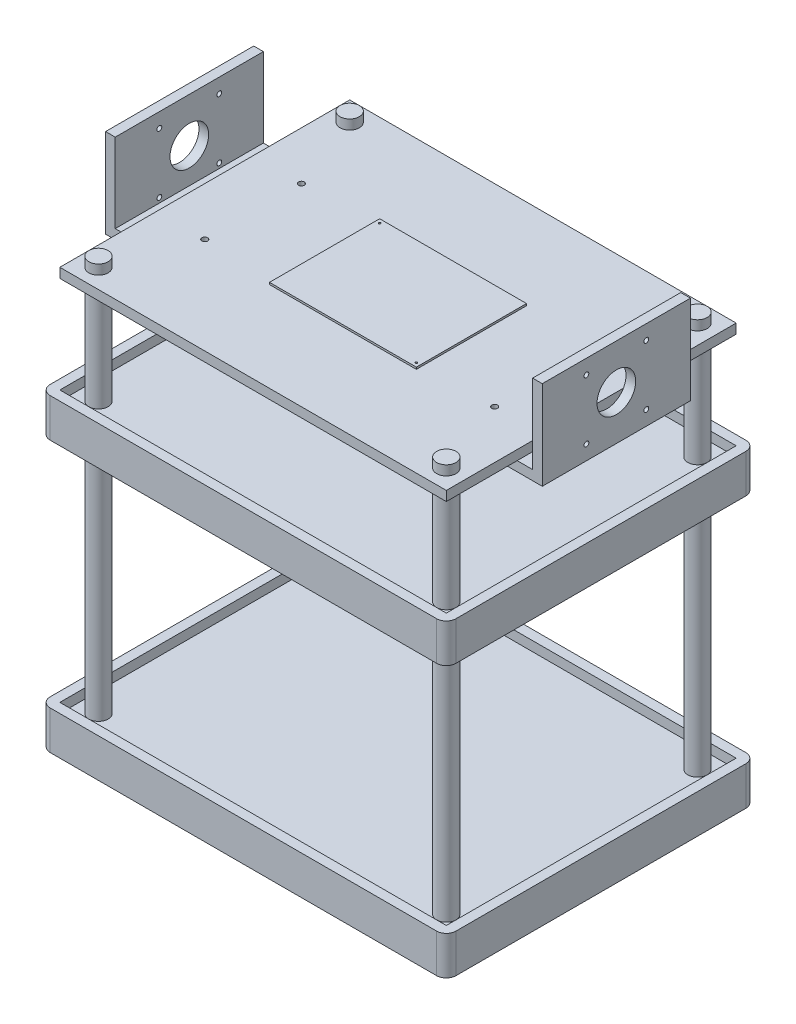
from build123d import *

# Parameters (mm, degrees)
SKETCH1_W            = 200
SKETCH1_H            = 150
BOSS_EXTRUDE1_DEPTH  = 5
SKETCH2_R            = 5
CUT_EXTRUDE1_DEPTH   = 10
SKETCH3_W            = 200
SKETCH3_H            = 150
SKETCH3_R            = 5
BOSS_EXTRUDE2_DEPTH  = 5
SKETCH4_W            = 200
SKETCH4_H            = 150
SKETCH4_R            = 5
BOSS_EXTRUDE3_DEPTH  = 5
BOSS_EXTRUDE13_START = 205
SKETCH21_R           = 5
BOSS_EXTRUDE13_DEPTH = 205
SKETCH22_R           = 5
BOSS_EXTRUDE14_DEPTH = 15
SKETCH23_R           = 1.5
CUT_EXTRUDE2_DEPTH   = 10
SKETCH27_W           = 76
SKETCH27_H           = 57
BOSS_EXTRUDE16_DEPTH = 1
SKETCH30_R           = 0.5
CUT_EXTRUDE3_DEPTH   = 30
SKETCH35_W           = 210
SKETCH35_H           = 160
SKETCH35_W_2         = 200
SKETCH35_H_2         = 150
BOSS_EXTRUDE19_DEPTH = 10
FILLET4_R            = 5
SKETCH39_W           = 210
SKETCH39_H           = 160
SKETCH39_W_2         = 200
SKETCH39_H_2         = 150
BOSS_EXTRUDE20_DEPTH = 10
FILLET5_R            = 5
SKETCH42_W           = 15
SKETCH42_H           = 20
SKETCH42_W_2         = 25
SKETCH42_H_2         = 50
SKETCH42_W_3         = 43.3
SKETCH42_H_3         = 43.3
BOSS_EXTRUDE23_DEPTH = 1
SKETCH46_W           = 30
SKETCH46_H           = 76.670556204
BOSS_EXTRUDE24_DEPTH = 5
SKETCH48_W           = 76.670556204
SKETCH48_H           = 46
SKETCH48_R           = 1.25
SKETCH48_R_2         = 10
BOSS_EXTRUDE25_DEPTH = 5
SKETCH54_W           = 76.670556204
SKETCH54_H           = 46
BOSS_EXTRUDE26_DEPTH = 5
SKETCH55_R           = 1.25
SKETCH55_R_2         = 10
CUT_EXTRUDE4_DEPTH   = 10


with BuildPart() as part:
    # Sketch1 → Boss-Extrude1 (new body)
    with BuildSketch(Plane(origin=(0, 0, 0), x_dir=(1, 0, 0), z_dir=(0, 1, 0))):
        Rectangle(SKETCH1_W, SKETCH1_H)
    extrude(amount=BOSS_EXTRUDE1_DEPTH)

    # Sketch2 → Cut-Extrude1 (cut)
    with BuildSketch(Plane(origin=(0, 5, 0), x_dir=(1, 0, 0), z_dir=(0, 1, 0))):
        with Locations(Location((-90, 65, 0), (0, 0, 270))):
            Circle(SKETCH2_R)
        with Locations(Location((90, 65, 0), (0, 0, 270))):
            Circle(SKETCH2_R)
        with Locations(Location((90, -65, 0), (0, 0, 270))):
            Circle(SKETCH2_R)
        with Locations(Location((-90, -65, 0), (0, 0, 270))):
            Circle(SKETCH2_R)
    extrude(amount=-CUT_EXTRUDE1_DEPTH, mode=Mode.SUBTRACT)



with BuildPart() as body_2:
    # Sketch3 → Boss-Extrude2 (new body)
    with BuildSketch(Plane(origin=(0, 140, 0), x_dir=(1, 0, 0), z_dir=(0, 1, 0))):
        Rectangle(SKETCH3_W, SKETCH3_H)
        with Locations(Location((-90, 65, 0), (0, 0, 270))):
            Circle(SKETCH3_R, mode=Mode.SUBTRACT)
        with Locations(Location((90, 65, 0), (0, 0, 270))):
            Circle(SKETCH3_R, mode=Mode.SUBTRACT)
        with Locations(Location((-90, -65, 0), (0, 0, 270))):
            Circle(SKETCH3_R, mode=Mode.SUBTRACT)
        with Locations(Location((90, -65, 0), (0, 0, 270))):
            Circle(SKETCH3_R, mode=Mode.SUBTRACT)
    extrude(amount=BOSS_EXTRUDE2_DEPTH)



with BuildPart() as body_3:
    # Sketch4 → Boss-Extrude3 (new body)
    with BuildSketch(Plane(origin=(0, 200, 0), x_dir=(1, 0, 0), z_dir=(0, 1, 0))):
        Rectangle(SKETCH4_W, SKETCH4_H)
        with Locations(Location((-90, 65, 0), (0, 0, 270))):
            Circle(SKETCH4_R, mode=Mode.SUBTRACT)
        with Locations(Location((90, 65, 0), (0, 0, 270))):
            Circle(SKETCH4_R, mode=Mode.SUBTRACT)
        with Locations(Location((90, -65, 0), (0, 0, 270))):
            Circle(SKETCH4_R, mode=Mode.SUBTRACT)
        with Locations(Location((-90, -65, 0), (0, 0, 270))):
            Circle(SKETCH4_R, mode=Mode.SUBTRACT)
    extrude(amount=BOSS_EXTRUDE3_DEPTH)


with BuildPart() as body_2_1:
    add(body_2.part)

    add(body_3.part)  # Boss-Extrude13 merges body 3
    # Sketch21 → Boss-Extrude13 (add)
    with BuildSketch(Plane(origin=(0, 5, 0), x_dir=(1, 0, 0), z_dir=(0, 1, 0)).offset(BOSS_EXTRUDE13_START)):
        with Locations(Location((-90, -65, 0), (0, 0, 270))):
            Circle(SKETCH21_R)
        with Locations(Location((-90, 65, 0), (0, 0, 270))):
            Circle(SKETCH21_R)
        with Locations(Location((90, 65, 0), (0, 0, 270))):
            Circle(SKETCH21_R)
        with Locations(Location((90, -65, 0), (0, 0, 270))):
            Circle(SKETCH21_R)
    extrude(amount=-BOSS_EXTRUDE13_DEPTH)


with BuildPart() as part_1:
    add(part.part)

    add(body_2_1.part)  # Boss-Extrude14 merges body 2
    # Sketch22 → Boss-Extrude14 (add)
    with BuildSketch(Plane(origin=(0, 5, 0), x_dir=(1, 0, 0), z_dir=(0, 1, 0))):
        with Locations(Location((-90, 65, 0), (0, 0, 270))):
            Circle(SKETCH22_R)
        with Locations(Location((-90, -65, 0), (0, 0, 270))):
            Circle(SKETCH22_R)
        with Locations(Location((90, -65, 0), (0, 0, 270))):
            Circle(SKETCH22_R)
        with Locations(Location((90, 65, 0), (0, 0, 270))):
            Circle(SKETCH22_R)
    extrude(amount=-BOSS_EXTRUDE14_DEPTH)

    # Sketch23 → Cut-Extrude2 (cut)
    with BuildSketch(Plane(origin=(0, 205, 0), x_dir=(1, 0, 0), z_dir=(0, 1, 0))):
        with Locations(Location((-75, 25, 0), (0, 0, 270))):
            Circle(SKETCH23_R)
        with Locations(Location((-75, -25, 0), (0, 0, 270))):
            Circle(SKETCH23_R)
        with Locations(Location((75, -25, 0), (0, 0, 270))):
            Circle(SKETCH23_R)
        with Locations(Location((75, 25, 0), (0, 0, 270))):
            Circle(SKETCH23_R)
    extrude(amount=-CUT_EXTRUDE2_DEPTH, mode=Mode.SUBTRACT)

    # Sketch27 → Boss-Extrude16 (add)
    with BuildSketch(Plane(origin=(0, 205, 0), x_dir=(1, 0, 0), z_dir=(0, 1, 0))):
        Rectangle(SKETCH27_W, SKETCH27_H)
    extrude(amount=BOSS_EXTRUDE16_DEPTH)

    # Sketch30 → Cut-Extrude3 (cut)
    with BuildSketch(Plane(origin=(0, 206, 0), x_dir=(1, 0, 0), z_dir=(0, 1, 0))):
        with Locations(Location((-36, 26.5, 0), (0, 0, 270))):
            Circle(SKETCH30_R)
        with Locations(Location((36, -26.5, 0), (0, 0, 270))):
            Circle(SKETCH30_R)
    extrude(amount=-CUT_EXTRUDE3_DEPTH, mode=Mode.SUBTRACT)

    # Sketch42 → Boss-Extrude23 (add)
    with BuildSketch(Plane.XZ.offset(-200)):
        Rectangle(SKETCH42_W, SKETCH42_H)
        with Locations((-58.240305189, 7.803312526)):
            Rectangle(SKETCH42_W_2, SKETCH42_H_2)
        with Locations((37.35, 2.211754737)):
            Rectangle(SKETCH42_W_3, SKETCH42_H_3)
    extrude(amount=BOSS_EXTRUDE23_DEPTH)

    # Sketch46 → Boss-Extrude24 (add)
    with BuildSketch(Plane(origin=(0, 200, 0), x_dir=(-1, 0, 0), z_dir=(0, -1, 0))):
        with Locations((-93, 0)):
            Rectangle(SKETCH46_W, SKETCH46_H)
        with Locations((93, 0)):
            Rectangle(SKETCH46_W, SKETCH46_H)
    extrude(amount=BOSS_EXTRUDE24_DEPTH)

    # Sketch48 → Boss-Extrude25 (add)
    with BuildSketch(Plane.ZY.offset(108)):
        with Locations((0, 218)):
            Rectangle(SKETCH48_W, SKETCH48_H)
        with Locations((-15.5, 202.5)):
            Circle(SKETCH48_R, mode=Mode.SUBTRACT)
        with Locations((15.5, 202.5)):
            Circle(SKETCH48_R, mode=Mode.SUBTRACT)
        with Locations(Location((15.5, 233.5, 0), (0, 0, 180))):
            Circle(SKETCH48_R, mode=Mode.SUBTRACT)
        with Locations(Location((-15.5, 233.5, 0), (0, 0, 180))):
            Circle(SKETCH48_R, mode=Mode.SUBTRACT)
        with Locations((0, 218)):
            Circle(SKETCH48_R_2, mode=Mode.SUBTRACT)
    extrude(amount=BOSS_EXTRUDE25_DEPTH)

    # Sketch54 → Boss-Extrude26 (add)
    with BuildSketch(Plane(origin=(108, 0, 0), x_dir=(0, 0, -1), z_dir=(1, 0, 0))):
        with Locations((0, 218)):
            Rectangle(SKETCH54_W, SKETCH54_H)
    extrude(amount=BOSS_EXTRUDE26_DEPTH)

    # Sketch55 → Cut-Extrude4 (cut)
    with BuildSketch(Plane(origin=(113, 0, 0), x_dir=(0, 0, -1), z_dir=(1, 0, 0))):
        with Locations(Location((-15.5, 202.5, 0), (0, 0, 180))):
            Circle(SKETCH55_R)
        with Locations(Location((15.5, 202.5, 0), (0, 0, 180))):
            Circle(SKETCH55_R)
        with Locations((15.5, 233.5)):
            Circle(SKETCH55_R)
        with Locations((-15.5, 233.5)):
            Circle(SKETCH55_R)
        with Locations(Location((0, 218, 0), (0, 0, 180))):
            Circle(SKETCH55_R_2)
    extrude(amount=-CUT_EXTRUDE4_DEPTH, mode=Mode.SUBTRACT)


with BuildPart() as body_2_2:
    # Sketch35 → Boss-Extrude19 (new, symmetric)
    with BuildSketch(Plane(origin=(0, 0, 0), x_dir=(-1, 0, 0), z_dir=(0, -1, 0))):
        Rectangle(SKETCH35_W, SKETCH35_H)
        Rectangle(SKETCH35_W_2, SKETCH35_H_2, mode=Mode.SUBTRACT)
    extrude(amount=BOSS_EXTRUDE19_DEPTH, both=True)

    # Fillet4
    fillet4_edges = [body_2_2.edges().sort_by_distance(p)[0] for p in [
        (105, 0, -80),
        (-105, 0, -80),
        (-105, 0, 80),
        (105, 0, 80),
    ]]
    fillet(fillet4_edges, radius=FILLET4_R)


with BuildPart() as body_3_2:
    # Sketch39 → Boss-Extrude20 (new, symmetric)
    with BuildSketch(Plane.XZ.offset(-140)):
        Rectangle(SKETCH39_W, SKETCH39_H)
        Rectangle(SKETCH39_W_2, SKETCH39_H_2, mode=Mode.SUBTRACT)
    extrude(amount=BOSS_EXTRUDE20_DEPTH, both=True)

    # Fillet5
    fillet5_edges = [body_3_2.edges().sort_by_distance(p)[0] for p in [
        (105, 140, -80),
        (-105, 140, -80),
        (-105, 140, 80),
        (105, 140, 80),
    ]]
    fillet(fillet5_edges, radius=FILLET5_R)


solid = Compound([part_1.part, body_2_2.part, body_3_2.part])
